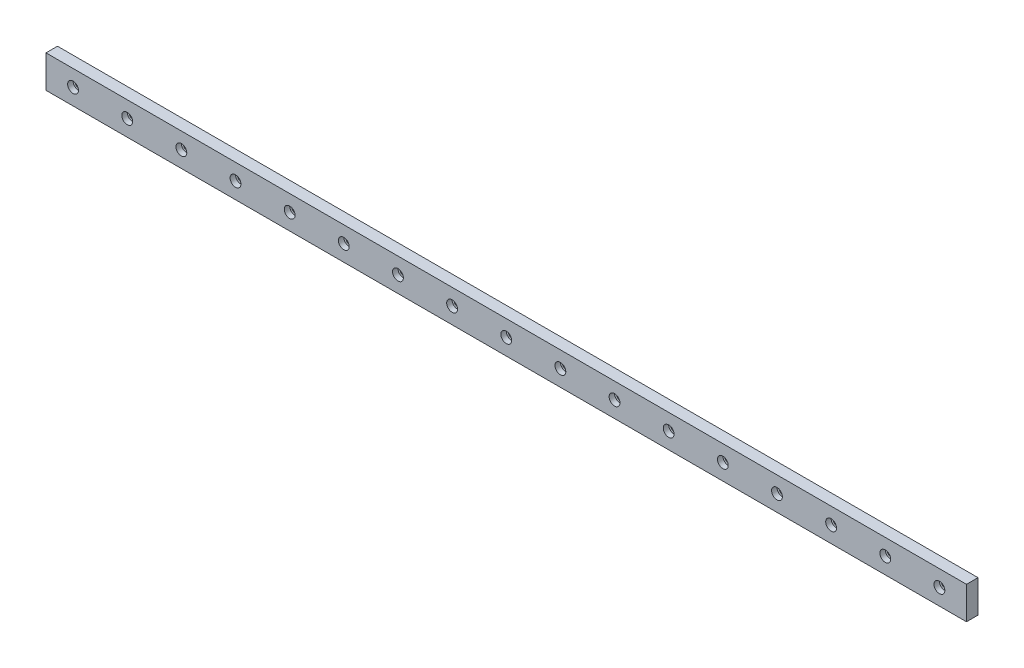
from build123d import *

# Parameters (mm, degrees)
SKETCH_1_W                   = 680
SKETCH_1_H                   = 24
EXTRUDE_1_DEPTH              = 8.5
HOLE_WIZARD_M4_1_D           = 4.8
HOLE_WIZARD_M4_1_CBORE_D     = 8
HOLE_WIZARD_M4_1_CBORE_DEPTH = 4
PATTERN_LINEAR_1_COUNT       = 17
PATTERN_LINEAR_1_PITCH       = 40


with BuildPart() as part:
    # 草图1 → 凸台-拉伸1 (new body)
    with BuildSketch(Plane.XY):
        with Locations((340, 12)):
            Rectangle(SKETCH_1_W, SKETCH_1_H)
    extrude(amount=EXTRUDE_1_DEPTH)

    # M4 六角凹头螺钉的柱形沉头孔1 (through all)
    with Locations(Plane.XY.offset(8.5)):
        with Locations((20, 12)):
            hole_wizard_m4_1 = CounterBoreHole(HOLE_WIZARD_M4_1_D / 2, HOLE_WIZARD_M4_1_CBORE_D / 2, HOLE_WIZARD_M4_1_CBORE_DEPTH)

    # 阵列(线性)1: M4 六角凹头螺钉的柱形沉头孔1 ×17
    with Locations(*[(i * PATTERN_LINEAR_1_PITCH, 0, 0) for i in range(1, PATTERN_LINEAR_1_COUNT)]):
        add(hole_wizard_m4_1, mode=Mode.SUBTRACT)


solid = part.part
